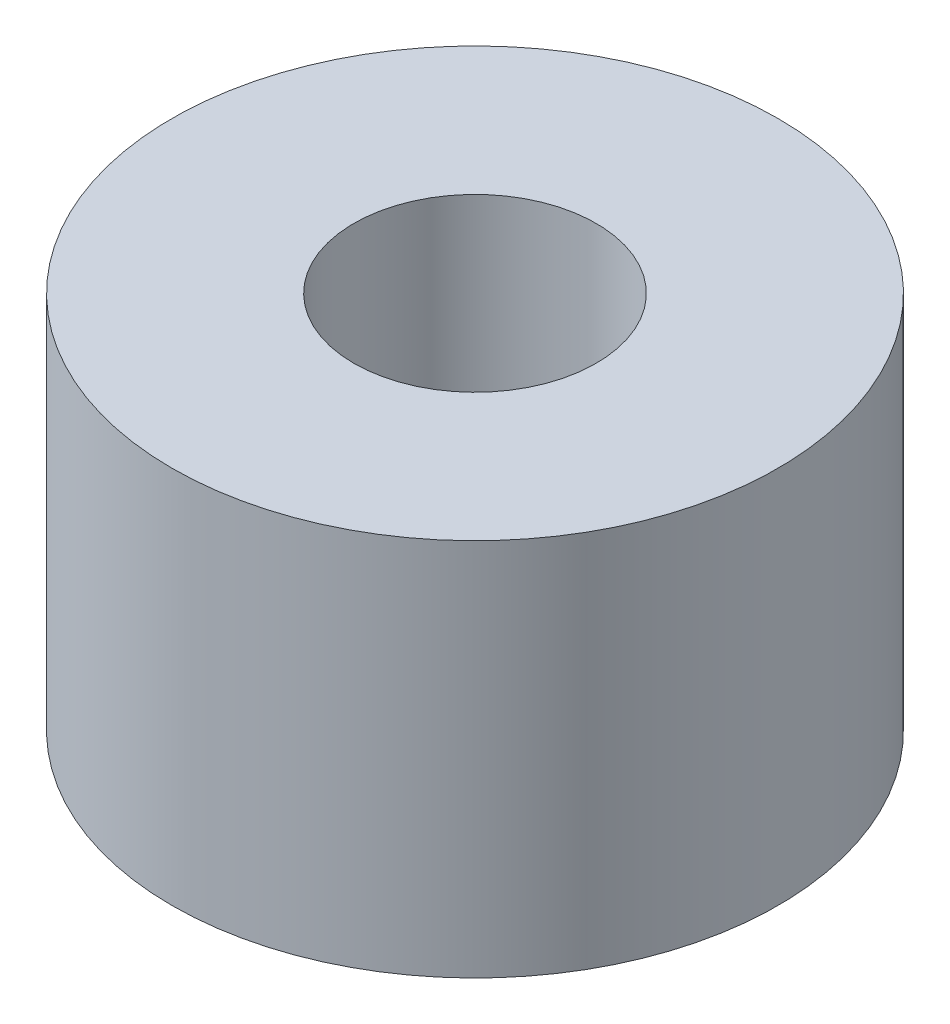
from build123d import *

# Parameters (mm, degrees)
SKETCH_1_R      = 4
SKETCH_1_R_2    = 1.6
EXTRUDE_1_DEPTH = 5


with BuildPart() as part:
    # 草图1 → 凸台-拉伸1 (new body)
    with BuildSketch(Plane(origin=(0, 0, 0), x_dir=(1, 0, 0), z_dir=(0, 1, 0))):
        with Locations(Location((0, 0, 0), (0, 0, 270))):
            Circle(SKETCH_1_R)
        with Locations(Location((0, 0, 0), (0, 0, 270))):
            Circle(SKETCH_1_R_2, mode=Mode.SUBTRACT)
    extrude(amount=EXTRUDE_1_DEPTH)


solid = part.part
